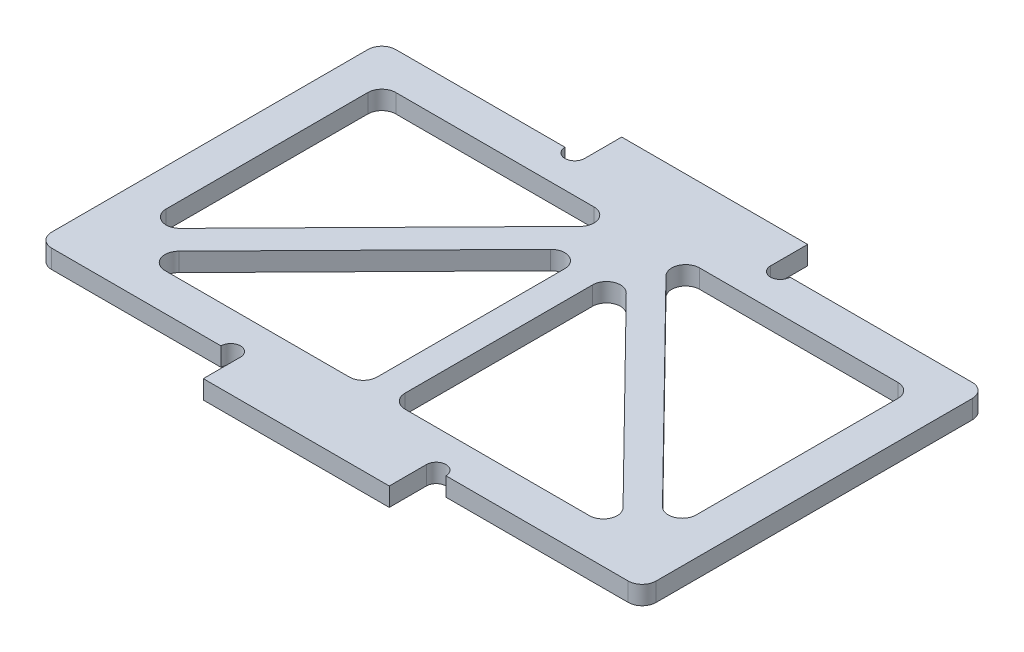
from build123d import *

# Parameters (mm, degrees)
SKETCH_1_W          = 65
SKETCH_1_H          = 37
EXTRUDE_1_DEPTH     = 2
SKETCH_2_W          = 20
SKETCH_2_H          = 2
EXTRUDE_2_DEPTH     = 4
SKETCH_3_R          = 1.05
CUT_EXTRUDE_1_DEPTH = 4
CUT_EXTRUDE_2_DEPTH = 10
FILLET_1_R          = 1.5


with BuildPart() as part:
    # 草图1 → 凸台-拉伸1 (new body)
    with BuildSketch(Plane(origin=(0, 0, 0), x_dir=(1, 0, 0), z_dir=(0, 1, 0))):
        Rectangle(SKETCH_1_W, SKETCH_1_H)
    extrude(amount=EXTRUDE_1_DEPTH)

    # 草图2 → 凸台-拉伸2 (add)
    with BuildSketch(Plane(origin=(0, 0, -18.5), x_dir=(-1, 0, 0), z_dir=(0, 0, -1))):
        with Locations((0.7, 1)):
            Rectangle(SKETCH_2_W, SKETCH_2_H)
    extrude_2 = extrude(amount=EXTRUDE_2_DEPTH)

    # 镜向1: 凸台-拉伸2 across plane
    add(extrude_2.mirror(Plane.XY))

    # 草图3 → 切除-拉伸1 (cut)
    with BuildSketch(Plane(origin=(0, 2, 0), x_dir=(1, 0, 0), z_dir=(0, 1, 0))):
        with Locations((10.35, -18.5)):
            Circle(SKETCH_3_R)
        with Locations((-11.75, -18.5)):
            Circle(SKETCH_3_R)
        with Locations((-11.75, 18.5)):
            Circle(SKETCH_3_R)
        with Locations((10.35, 18.5)):
            Circle(SKETCH_3_R)
    extrude(amount=-CUT_EXTRUDE_1_DEPTH, mode=Mode.SUBTRACT)

    # 草图4 → 切除-拉伸2 (cut)
    with BuildSketch(Plane(origin=(0, 2, 0), x_dir=(1, 0, 0), z_dir=(0, 1, 0))):
        Polygon((-28.5, 14.5), (-28.5, -12.35999068), (-2.103112607, 14.5), align=None)
        Polygon((-26.396887393, -14.5), (-1.5, -14.5), (-1.5, 10.833674891), align=None)
        Polygon((1.5, 10.833674891), (1.5, -14.5), (26.396887393, -14.5), align=None)
        Polygon((2.103112607, 14.5), (28.5, -12.35999068), (28.5, 14.5), align=None)
    extrude(amount=-CUT_EXTRUDE_2_DEPTH, mode=Mode.SUBTRACT)

    # 圆角1
    fillet_1_edges = [part.edges().sort_by_distance(p)[0] for p in [
        (2.103112607, 1, -14.5),
        (28.5, 1, -14.5),
        (28.5, 1, 12.35999068),
        (-2.103112607, 1, -14.5),
        (-28.5, 1, 12.35999068),
        (-28.5, 1, -14.5),
        (32.5, 1, 18.5),
        (-32.5, 1, 18.5),
        (-32.5, 1, -18.5),
        (32.5, 1, -18.5),
        (-1.5, 1, -10.833674891),
        (-1.5, 1, 14.5),
        (-26.396887393, 1, 14.5),
        (1.5, 1, -10.833674891),
        (26.396887393, 1, 14.5),
        (1.5, 1, 14.5),
    ]]
    fillet(fillet_1_edges, radius=FILLET_1_R)


solid = part.part
